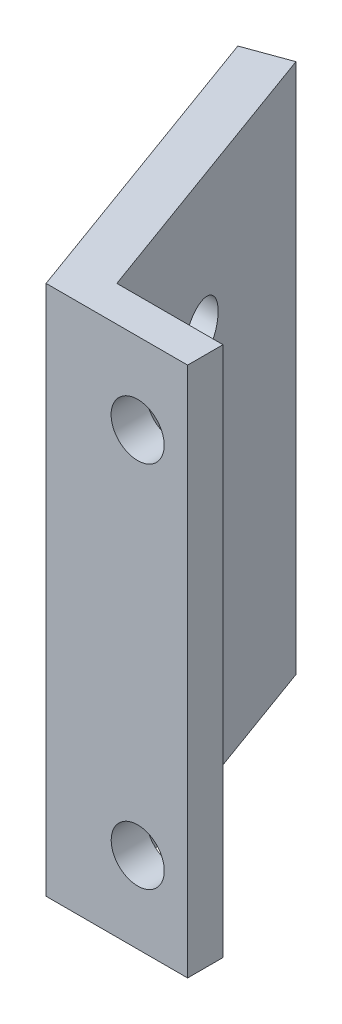
from build123d import *

# Parameters (mm, degrees)
BOSS_EXTRUDE1_DEPTH = 30
SKETCH2_R           = 1.5
CUT_EXTRUDE1_DEPTH  = 30
SKETCH3_R           = 1.5
CUT_EXTRUDE2_DEPTH  = 30


with BuildPart() as part:
    # Sketch1 → Boss-Extrude1 (new body)
    with BuildSketch(Plane(origin=(0, 0, 0), x_dir=(1, 0, 0), z_dir=(0, 1, 0))):
        Polygon((-4.53610988, -6.260301285), (3.46389012, -6.260301285), (3.46389012, -4.260301285), (-2.53610988, -4.260301285), (-8.328469686, 11.654076488), (-10.737301739, 10.777333321), align=None)
    extrude(amount=BOSS_EXTRUDE1_DEPTH)

    # Sketch2 → Cut-Extrude1 (cut)
    with BuildSketch(Plane(origin=(0, 0, 4.260301285), x_dir=(-1, 0, 0), z_dir=(0, 0, -1))):
        with Locations((-0.63889012, 25.414)):
            Circle(SKETCH2_R)
        with Locations((-0.64389012, 4.59)):
            Circle(SKETCH2_R)
    extrude(amount=-CUT_EXTRUDE1_DEPTH, mode=Mode.SUBTRACT)

    # Sketch3 → Cut-Extrude2 (cut)
    with BuildSketch(Plane(origin=(-2.53610988, 0, 0), x_dir=(0, 0, -1), z_dir=(1, 0, 0))):
        with Locations(Location((3.239698715, 22.5, 0), (0, 0, 180))):
            Circle(SKETCH3_R)
        with Locations(Location((3.239698715, 7.5, 0), (0, 0, 180))):
            Circle(SKETCH3_R)
    extrude(amount=-CUT_EXTRUDE2_DEPTH, mode=Mode.SUBTRACT)


solid = part.part
